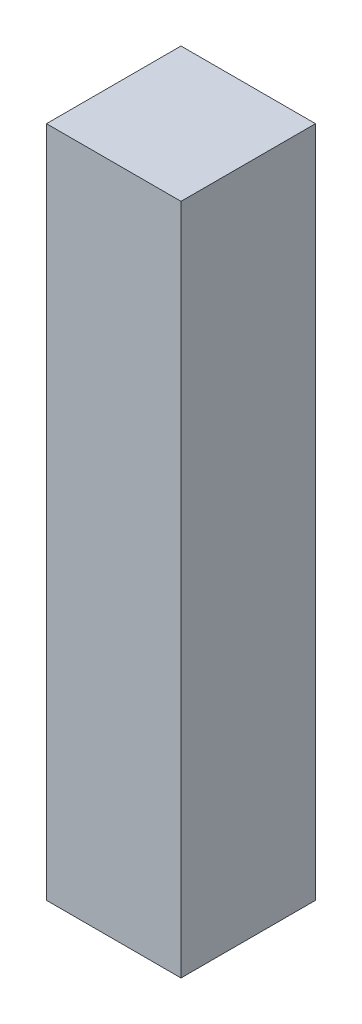
from build123d import *

# Parameters (mm, degrees)
SKETCH1_W           = 40
SKETCH1_H           = 40
BOSS_EXTRUDE1_DEPTH = 200


with BuildPart() as part:
    # Sketch1 → Boss-Extrude1 (new body)
    with BuildSketch(Plane(origin=(0, 0, 0), x_dir=(1, 0, 0), z_dir=(0, 1, 0))):
        Rectangle(SKETCH1_W, SKETCH1_H)
    extrude(amount=BOSS_EXTRUDE1_DEPTH)


solid = part.part
